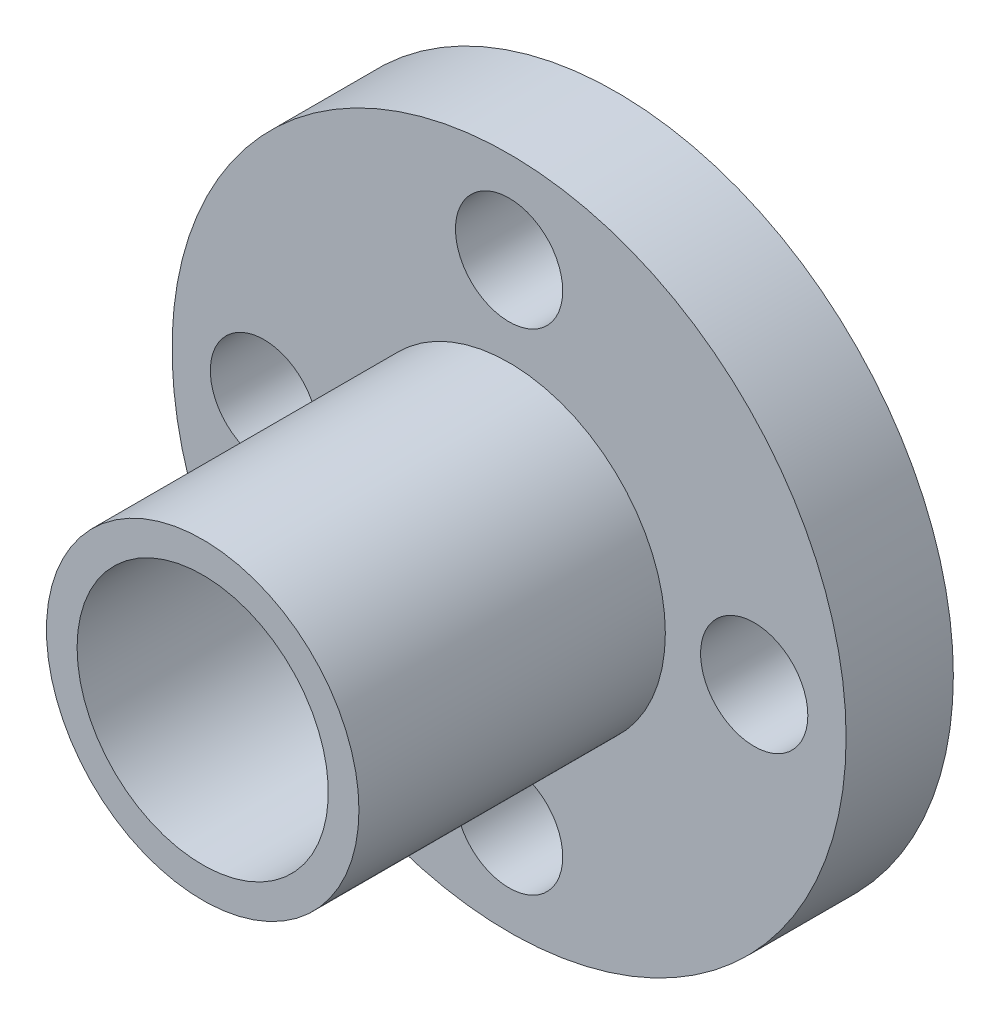
from build123d import *

# Parameters (mm, degrees)
SKETCH1_R           = 5.1
BOSS_EXTRUDE1_DEPTH = 15
SKETCH2_R           = 11
SKETCH2_R_2         = 1.75
BOSS_EXTRUDE2_DEPTH = 3.5
SKETCH3_R           = 4.1
CUT_EXTRUDE1_DEPTH  = 22.610182785


with BuildPart() as part:
    # Sketch1 → Boss-Extrude1 (new body)
    with BuildSketch(Plane.XY):
        Circle(SKETCH1_R)
    extrude(amount=BOSS_EXTRUDE1_DEPTH)

    # Sketch2 → Boss-Extrude2 (add)
    with BuildSketch(Plane.XY.offset(1.5)):
        Circle(SKETCH2_R)
        with Locations((0, 8)):
            Circle(SKETCH2_R_2, mode=Mode.SUBTRACT)
        with Locations((8, 0)):
            Circle(SKETCH2_R_2, mode=Mode.SUBTRACT)
        with Locations((0, -8)):
            Circle(SKETCH2_R_2, mode=Mode.SUBTRACT)
        with Locations((-8, 0)):
            Circle(SKETCH2_R_2, mode=Mode.SUBTRACT)
    extrude(amount=BOSS_EXTRUDE2_DEPTH)

    # Sketch3 → Cut-Extrude1 (cut, through all)
    with BuildSketch(Plane(origin=(0, 0, 0), x_dir=(-1, 0, 0), z_dir=(0, 0, -1))):
        Circle(SKETCH3_R)
    extrude(amount=-CUT_EXTRUDE1_DEPTH, mode=Mode.SUBTRACT)


solid = part.part
